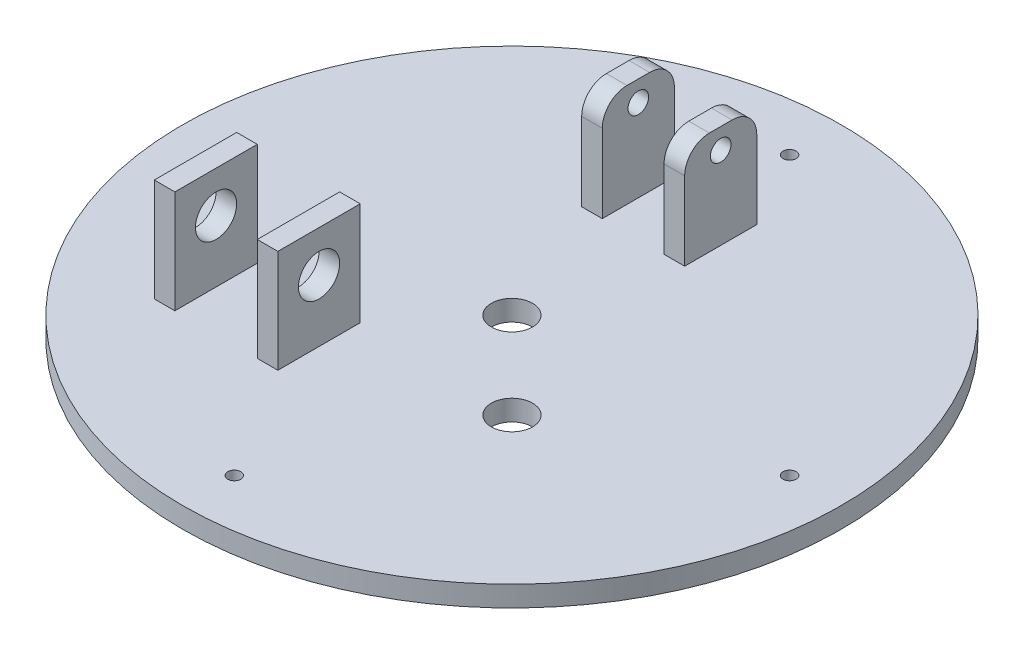
from build123d import *

# Parameters (mm, degrees)
SKETCH1_R                  = 101.6
BOSS_EXTRUDE1_DEPTH        = 6.35
SKETCH2_R                  = 6.35
CUT_EXTRUDE1_DEPTH         = 144.824345992
SKETCH3_W                  = 6.35
SKETCH3_H                  = 25.4
BOSS_EXTRUDE2_DEPTH        = 31.75
CUT_EXTRUDE2_REACH         = 165.994
SKETCH4_R                  = 6.35
SKETCH5_W                  = 6.35
SKETCH5_H                  = 22.225
BOSS_EXTRUDE3_DEPTH        = 31.75
CUT_EXTRUDE3_REACH         = 163.627
SKETCH6_R                  = 3.175
F_10_32_TAPPED_HOLE1_D     = 4.0386
F_10_32_TAPPED_HOLE1_DEPTH = 12.02944
F_10_32_TAPPED_HOLE1_TIP   = 1.213317848
FILLET1_R                  = 7.62
SKETCH9_R                  = 6.35
CUT_EXTRUDE4_DEPTH         = 148.150203873


with BuildPart() as part:
    # Sketch1 → Boss-Extrude1 (new body)
    with BuildSketch(Plane(origin=(0, 0, 0), x_dir=(1, 0, 0), z_dir=(0, 1, 0))):
        with Locations(Location((0, 0, 0), (0, 0, 270))):
            Circle(SKETCH1_R)
    extrude(amount=BOSS_EXTRUDE1_DEPTH)

    # Sketch2 → Cut-Extrude1 (cut, through all)
    with BuildSketch(Plane.XZ):
        with Locations(Location((0, 0, 0), (0, 0, 270))):
            Circle(SKETCH2_R)
    extrude(amount=-CUT_EXTRUDE1_DEPTH, mode=Mode.SUBTRACT)

    # Sketch3 → Boss-Extrude2 (add)
    with BuildSketch(Plane(origin=(0, 6.35, 0), x_dir=(1, 0, 0), z_dir=(0, 1, 0))):
        with Locations((-56.28767, -38.1)):
            Rectangle(SKETCH3_W, SKETCH3_H)
        with Locations((-24.53767, -38.1)):
            Rectangle(SKETCH3_W, SKETCH3_H)
    extrude(amount=BOSS_EXTRUDE2_DEPTH)

    # Cut-Extrude2: up to this face of the body (flat: up to its plane)
    cut_extrude2_end = Plane(part.part.faces().sort_by_distance((-59.46267, 22.225, 38.1))[0])
    # Sketch4 → Cut-Extrude2 (cut, up to the picked face)
    with BuildSketch(Plane(origin=(-21.36267, 0, 0), x_dir=(0, 0, -1), z_dir=(1, 0, 0)), mode=Mode.PRIVATE) as cut_extrude2_sk1:
        with Locations((-38.1, 25.4)):
            Circle(SKETCH4_R)
    cut_extrude2_tool1 = split(extrude(cut_extrude2_sk1.sketch, amount=-CUT_EXTRUDE2_REACH, mode=Mode.PRIVATE), bisect_by=cut_extrude2_end, keep=Keep.BOTH, mode=Mode.PRIVATE)
    add(cut_extrude2_tool1.solids().sort_by(Axis((-21.36267, 25.4, 38.1), (-1, 0, 0)))[0], mode=Mode.SUBTRACT)

    # Sketch5 → Boss-Extrude3 (add)
    with BuildSketch(Plane(origin=(0, 6.35, 0), x_dir=(1, 0, 0), z_dir=(0, 1, 0))):
        with Locations((-15.01267, 50.8)):
            Rectangle(SKETCH5_W, SKETCH5_H)
        with Locations((10.38733, 50.8)):
            Rectangle(SKETCH5_W, SKETCH5_H)
    extrude(amount=BOSS_EXTRUDE3_DEPTH)

    # Cut-Extrude3: up to this face of the body (flat: up to its plane)
    cut_extrude3_end = Plane(part.part.faces().sort_by_distance((13.56233, 22.225, -50.8))[0])
    # Sketch6 → Cut-Extrude3 (cut, up to the picked face)
    with BuildSketch(Plane.ZY.offset(18.18767), mode=Mode.PRIVATE) as cut_extrude3_sk1:
        with Locations((-50.8, 31.75)):
            Circle(SKETCH6_R)
    cut_extrude3_tool1 = split(extrude(cut_extrude3_sk1.sketch, amount=-CUT_EXTRUDE3_REACH, mode=Mode.PRIVATE), bisect_by=cut_extrude3_end, keep=Keep.BOTH, mode=Mode.PRIVATE)
    add(cut_extrude3_tool1.solids().sort_by(Axis((-18.18767, 31.75, -50.8), (1, 0, 0)))[0], mode=Mode.SUBTRACT)

    # #10-32 Tapped Hole1
    with Locations(Plane(origin=(0, 0, 0), x_dir=(-1, 0, 0), z_dir=(0, -1, 0))):
        with Locations((0, 0), (0, -85.599801346), (-85.599801346, 0), (0, 85.599801346), (85.599801346, 0)):
            Hole(F_10_32_TAPPED_HOLE1_D / 2, depth=F_10_32_TAPPED_HOLE1_DEPTH)
            with Locations((0, 0, -(F_10_32_TAPPED_HOLE1_DEPTH + F_10_32_TAPPED_HOLE1_TIP / 2))):  # 118° drill point
                Cone(0, F_10_32_TAPPED_HOLE1_D / 2, F_10_32_TAPPED_HOLE1_TIP, mode=Mode.SUBTRACT)

    # Fillet1
    fillet1_edges = [part.edges().sort_by_distance(p)[0] for p in [
        (-15.01267, 38.1, -39.6875),
        (-15.01267, 38.1, -61.9125),
        (10.38733, 38.1, -39.6875),
        (10.38733, 38.1, -61.9125),
    ]]
    fillet(fillet1_edges, radius=FILLET1_R)

    # Sketch9 → Cut-Extrude4 (cut, through all)
    with BuildSketch(Plane(origin=(0, 6.35, 0), x_dir=(1, 0, 0), z_dir=(0, 1, 0))):
        with Locations(Location((26.662380423, -26.662380423, 0), (0, 0, 270))):
            Circle(SKETCH9_R)
    extrude(amount=-CUT_EXTRUDE4_DEPTH, mode=Mode.SUBTRACT)


solid = part.part
